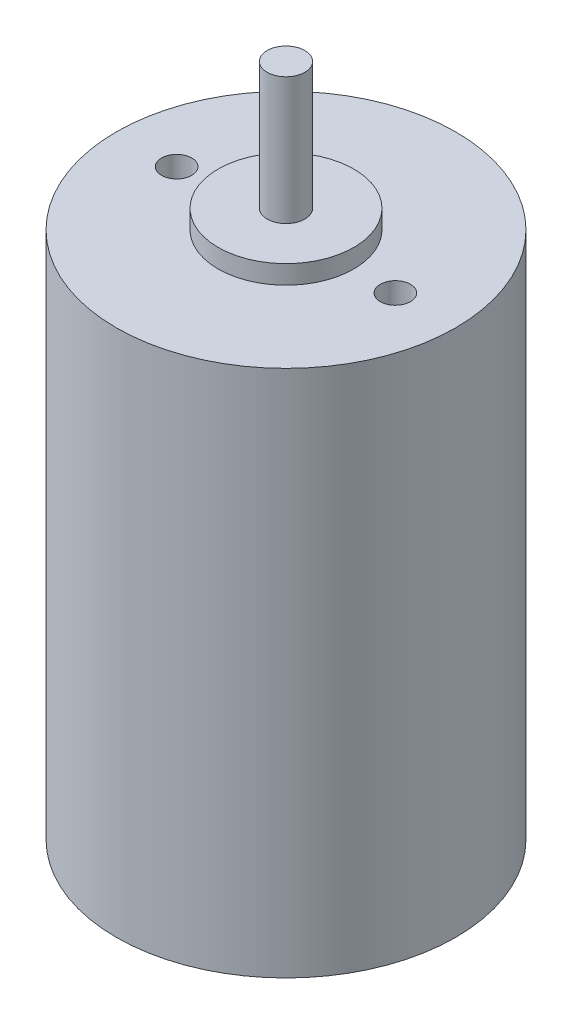
from build123d import *

# Parameters (mm, degrees)
SKETCH1_R           = 22.5
BOSS_EXTRUDE1_DEPTH = 70
SKETCH2_R           = 9
BOSS_EXTRUDE2_DEPTH = 2.48
SKETCH3_R           = 2.5
BOSS_EXTRUDE3_DEPTH = 16.86
SKETCH4_R           = 2
CUT_EXTRUDE1_DEPTH  = 4


with BuildPart() as part:
    # Sketch1 → Boss-Extrude1 (new body)
    with BuildSketch(Plane(origin=(0, 0, 0), x_dir=(1, 0, 0), z_dir=(0, 1, 0))):
        with Locations(Location((0, 0, 0), (0, 0, 270))):
            Circle(SKETCH1_R)
    extrude(amount=BOSS_EXTRUDE1_DEPTH)

    # Sketch2 → Boss-Extrude2 (add)
    with BuildSketch(Plane(origin=(0, 70, 0), x_dir=(1, 0, 0), z_dir=(0, 1, 0))):
        with Locations(Location((0, 0, 0), (0, 0, 270))):
            Circle(SKETCH2_R)
    extrude(amount=BOSS_EXTRUDE2_DEPTH)

    # Sketch3 → Boss-Extrude3 (add)
    with BuildSketch(Plane(origin=(0, 72.48, 0), x_dir=(1, 0, 0), z_dir=(0, 1, 0))):
        with Locations(Location((0, 0, 0), (0, 0, 270))):
            Circle(SKETCH3_R)
    extrude(amount=BOSS_EXTRUDE3_DEPTH)

    # Sketch4 → Cut-Extrude1 (cut)
    with BuildSketch(Plane(origin=(0, 70, 0), x_dir=(1, 0, 0), z_dir=(0, 1, 0))):
        with Locations(Location((-14.5, 0, 0), (0, 0, 270))):
            Circle(SKETCH4_R)
        with Locations(Location((14.5, 0, 0), (0, 0, 270))):
            Circle(SKETCH4_R)
    extrude(amount=-CUT_EXTRUDE1_DEPTH, mode=Mode.SUBTRACT)


solid = part.part
